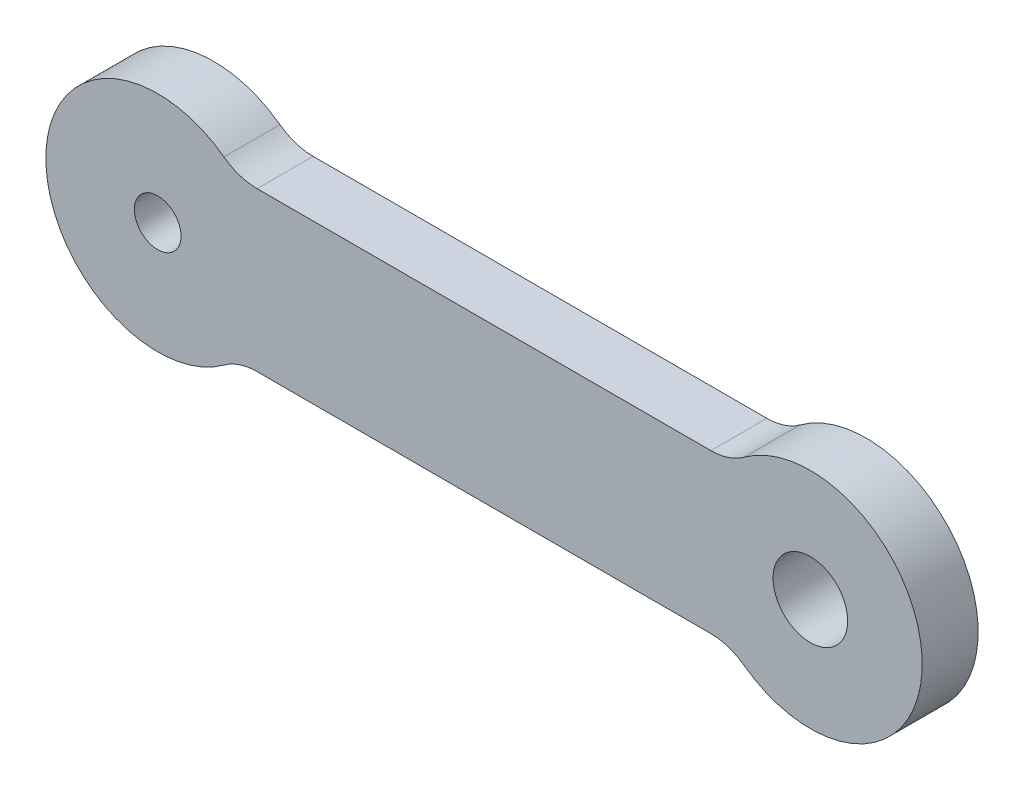
from build123d import *

# Parameters (mm, degrees)
SKETCH_1_R      = 1.25
SKETCH_1_R_2    = 2
EXTRUDE_1_DEPTH = 3


with BuildPart() as part:
    # 草图1 → 凸台-拉伸1 (new body)
    with BuildSketch(Plane.XY):
        with BuildLine():
            Line((29.667317748, 4.25), (5.332682252, 4.25))
            ThreePointArc((5.332682252, 4.25), (4.397267905, 4.399561437), (3.555121501, 4.833333333))
            ThreePointArc((3.555121501, 4.833333333), (-6, 0), (3.555121501, -4.833333333))
            ThreePointArc((3.555121501, -4.833333333), (4.397267905, -4.399561437), (5.332682252, -4.25))
            Line((5.332682252, -4.25), (29.667317748, -4.25))
            ThreePointArc((29.667317748, -4.25), (30.602732095, -4.399561437), (31.444878499, -4.833333333))
            ThreePointArc((31.444878499, -4.833333333), (41, 0), (31.444878499, 4.833333333))
            ThreePointArc((31.444878499, 4.833333333), (30.602732095, 4.399561437), (29.667317748, 4.25))
        make_face()
        Circle(SKETCH_1_R, mode=Mode.SUBTRACT)
        with Locations((35, 0)):
            Circle(SKETCH_1_R_2, mode=Mode.SUBTRACT)
    extrude(amount=EXTRUDE_1_DEPTH)


solid = part.part
